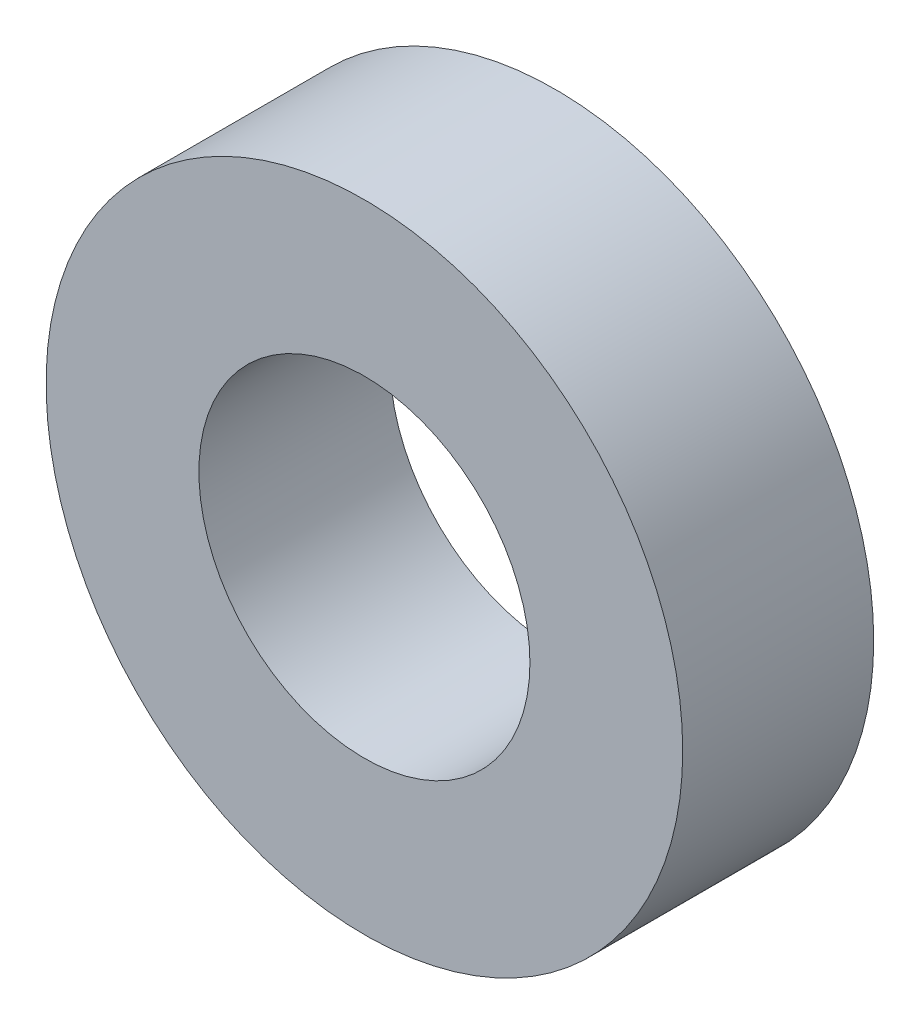
from build123d import *

# Parameters (mm, degrees)
SKETCH_1_R      = 5
SKETCH_1_R_2    = 2.6
EXTRUDE_1_DEPTH = 3


with BuildPart() as part:
    # 草图1 → 凸台-拉伸1 (new body)
    with BuildSketch(Plane.XY):
        Circle(SKETCH_1_R)
        Circle(SKETCH_1_R_2, mode=Mode.SUBTRACT)
    extrude(amount=EXTRUDE_1_DEPTH)


solid = part.part
